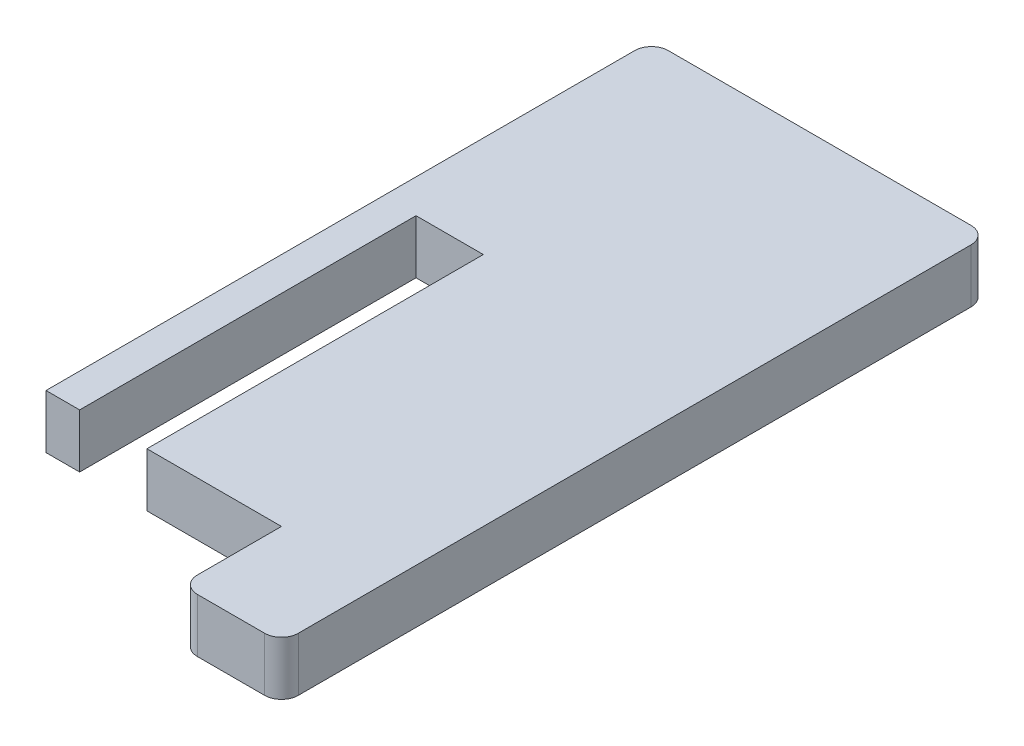
from build123d import *

# Parameters (mm, degrees)
BOSS_EXTRUDE1_DEPTH = 1.6


with BuildPart() as part:
    # Sketch2 → Boss-Extrude1 (new body)
    with BuildSketch(Plane(origin=(0, 0, 0), x_dir=(1, 0, 0), z_dir=(0, 1, 0))):
        with BuildLine():
            Line((606.412306421, -61.448413556), (608.412306421, -61.448413556))
            ThreePointArc((608.412306421, -61.448413556), (608.765859812, -61.301966947), (608.912306421, -60.948413556))
            Line((608.912306421, -60.948413556), (608.912306421, -40.948413556))
            ThreePointArc((608.912306421, -40.948413556), (608.765859812, -40.594860166), (608.412306421, -40.448413556))
            Line((608.412306421, -40.448413556), (599.412306421, -40.448413556))
            ThreePointArc((599.412306421, -40.448413556), (599.05875303, -40.594860166), (598.912306421, -40.948413556))
            Line((598.912306421, -40.948413556), (598.912306421, -58.448413556))
            Line((598.912306421, -58.448413556), (599.662306421, -58.448413556))
            Line((599.662306421, -58.448413556), (599.912306421, -58.448413556))
            Line((599.912306421, -58.448413556), (599.912306421, -48.448413556))
            Line((599.912306421, -48.448413556), (601.912306421, -48.448413556))
            Line((601.912306421, -48.448413556), (601.912306421, -58.448413556))
            Line((601.912306421, -58.448413556), (602.162306421, -58.448413556))
            Line((602.162306421, -58.448413556), (605.912306421, -58.448413556))
            Line((605.912306421, -58.448413556), (605.912306421, -60.948413556))
            ThreePointArc((605.912306421, -60.948413556), (606.05875303, -61.301966947), (606.412306421, -61.448413556))
        make_face()
    extrude(amount=BOSS_EXTRUDE1_DEPTH)


solid = part.part
